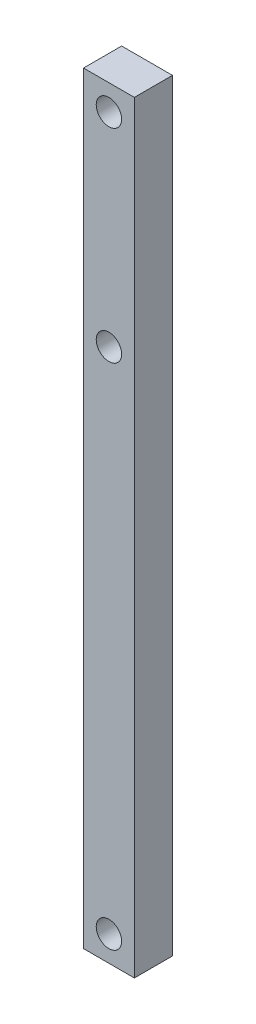
from build123d import *

# Parameters (mm, degrees)
SKETCH1_W           = 20
SKETCH1_H           = 300
BOSS_EXTRUDE1_DEPTH = 15
SKETCH3_R           = 5
CUT_EXTRUDE1_DEPTH  = 15


with BuildPart() as part:
    # Sketch1 → Boss-Extrude1 (new body)
    with BuildSketch(Plane.XY):
        Rectangle(SKETCH1_W, SKETCH1_H)
    extrude(amount=BOSS_EXTRUDE1_DEPTH)

    # Sketch3 → Cut-Extrude1 (cut)
    with BuildSketch(Plane(origin=(0, 0, 0), x_dir=(-1, 0, 0), z_dir=(0, 0, -1))):
        with Locations((0, -140)):
            Circle(SKETCH3_R)
        with Locations((0, 140)):
            Circle(SKETCH3_R)
        with Locations((0, 60)):
            Circle(SKETCH3_R)
    extrude(amount=-CUT_EXTRUDE1_DEPTH, mode=Mode.SUBTRACT)


solid = part.part
